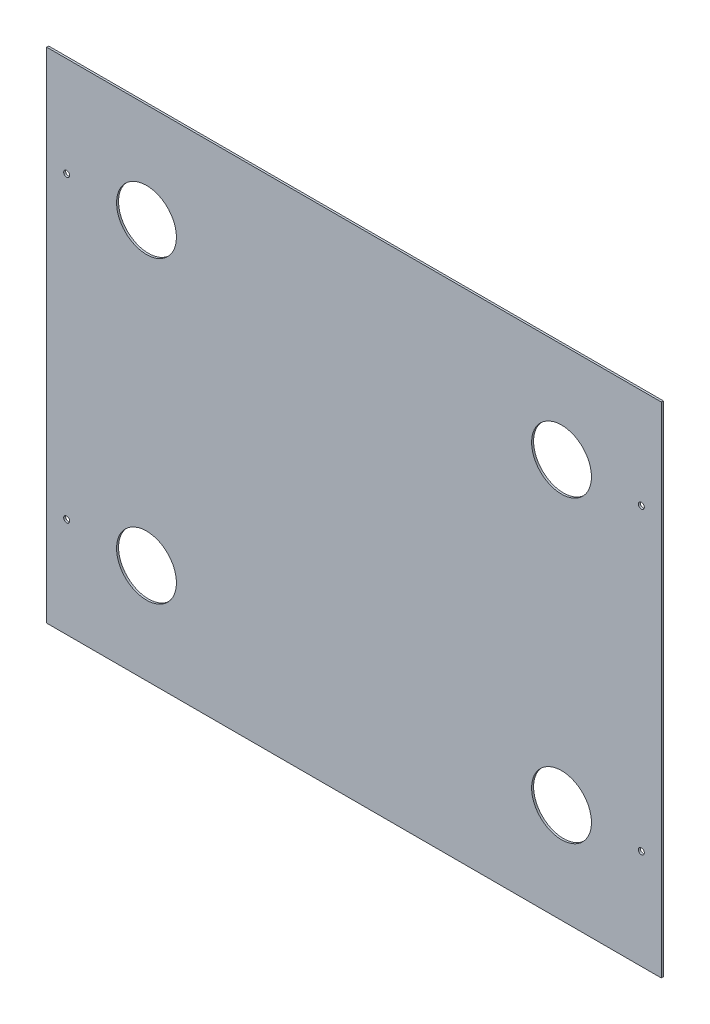
from build123d import *

# Parameters (mm, degrees)
ESQUISSE2_W                = 308
ESQUISSE2_H                = 250
BOSS_EXTRU_1_DEPTH         = 1
ESQUISSE3_R                = 1.5
ENL_V_MAT_EXTRU_1_DEPTH    = 397.692576185
R_P_TITION_LIN_AIRE1_COUNT = 2
R_P_TITION_LIN_AIRE1_PITCH = 150
ESQUISSE4_R                = 15
ENL_V_MAT_EXTRU_2_DEPTH    = 397.692576185


with BuildPart() as part:
    # Esquisse2 → Boss.-Extru.1 (new body)
    with BuildSketch(Plane.XY):
        with Locations((154, 125)):
            Rectangle(ESQUISSE2_W, ESQUISSE2_H)
    extrude(amount=BOSS_EXTRU_1_DEPTH)

    # Esquisse3 → Enlèv. mat.-Extru.1 (cut, through all)
    with BuildSketch(Plane.XY.offset(1)):
        with Locations((10, 200)):
            Circle(ESQUISSE3_R)
        with Locations((298, 200)):
            Circle(ESQUISSE3_R)
    enl_v_mat_extru_1 = extrude(amount=-ENL_V_MAT_EXTRU_1_DEPTH, mode=Mode.SUBTRACT)

    # Répétition linéaire1: Enlèv. mat.-Extru.1 ×2
    with Locations(*[(0, -i * R_P_TITION_LIN_AIRE1_PITCH, 0) for i in range(1, R_P_TITION_LIN_AIRE1_COUNT)]):
        add(enl_v_mat_extru_1, mode=Mode.SUBTRACT)

    # Esquisse4 → Enlèv. mat.-Extru.2 (cut, through all)
    with BuildSketch(Plane.XY.offset(1)):
        with Locations((50, 200)):
            Circle(ESQUISSE4_R)
        with Locations((258, 200)):
            Circle(ESQUISSE4_R)
        with Locations((50, 50)):
            Circle(ESQUISSE4_R)
        with Locations((258, 50)):
            Circle(ESQUISSE4_R)
    extrude(amount=-ENL_V_MAT_EXTRU_2_DEPTH, mode=Mode.SUBTRACT)


solid = part.part
